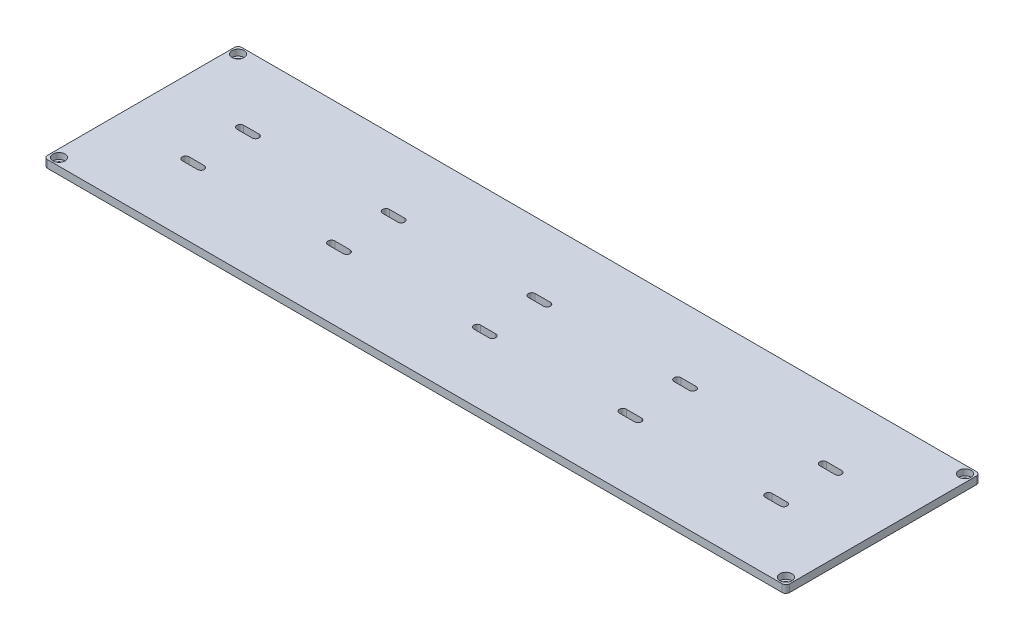
from build123d import *

# Parameters (mm, degrees)
SKETCH1_W                      = 488.95
SKETCH1_H                      = 128
BOSS_EXTRUDE1_DEPTH            = 5
CBORE_FOR_M4_SHCS1_D           = 4.5
CBORE_FOR_M4_SHCS1_DEPTH       = 17.38
CBORE_FOR_M4_SHCS1_CBORE_D     = 8
CBORE_FOR_M4_SHCS1_CBORE_DEPTH = 4
CBORE_FOR_M4_SHCS1_TIP         = 1.351936393
FILLET1_R                      = 2.5
CUT_EXTRUDE1_DEPTH             = 253.762785285
LPATTERN1_COUNT                = 5
LPATTERN1_PITCH                = 96


with BuildPart() as part:
    # Sketch1 → Boss-Extrude1 (new body)
    with BuildSketch(Plane(origin=(0, 0, 0), x_dir=(1, 0, 0), z_dir=(0, 1, 0))):
        Rectangle(SKETCH1_W, SKETCH1_H)
    extrude(amount=BOSS_EXTRUDE1_DEPTH)

    # CBORE for M4 SHCS1
    with Locations(Plane(origin=(0, 5, 0), x_dir=(1, 0, 0), z_dir=(0, 1, 0))):
        with Locations((-239.475, 59), (-239.475, -59), (239.475, -59), (239.475, 59)):
            CounterBoreHole(CBORE_FOR_M4_SHCS1_D / 2, CBORE_FOR_M4_SHCS1_CBORE_D / 2, CBORE_FOR_M4_SHCS1_CBORE_DEPTH, depth=CBORE_FOR_M4_SHCS1_DEPTH)
            with Locations((0, 0, -(CBORE_FOR_M4_SHCS1_DEPTH + CBORE_FOR_M4_SHCS1_TIP / 2))):  # 118° drill point
                Cone(0, CBORE_FOR_M4_SHCS1_D / 2, CBORE_FOR_M4_SHCS1_TIP, mode=Mode.SUBTRACT)

    # Fillet1
    fillet1_edges = [part.edges().sort_by_distance(p)[0] for p in [
        (244.475, 2.5, 64),
        (-244.475, 2.5, 64),
        (-244.475, 2.5, -64),
        (244.475, 2.5, -64),
    ]]
    fillet(fillet1_edges, radius=FILLET1_R)

    # Sketch4 → Cut-Extrude1 (cut, through all)
    with BuildSketch(Plane(origin=(0, 5, 0), x_dir=(1, 0, 0), z_dir=(0, 1, 0))):
        with BuildLine():
            Line((-196.975, 20.25), (-186.975, 20.25))
            ThreePointArc((-186.975, 20.25), (-184.725, 18), (-186.975, 15.75))
            Line((-186.975, 15.75), (-196.975, 15.75))
            ThreePointArc((-196.975, 15.75), (-199.225, 18), (-196.975, 20.25))
        make_face()
        with BuildLine():
            Line((-196.975, -15.75), (-186.975, -15.75))
            ThreePointArc((-186.975, -15.75), (-184.725, -18), (-186.975, -20.25))
            Line((-186.975, -20.25), (-196.975, -20.25))
            ThreePointArc((-196.975, -20.25), (-199.225, -18), (-196.975, -15.75))
        make_face()
    cut_extrude1 = extrude(amount=-CUT_EXTRUDE1_DEPTH, mode=Mode.SUBTRACT)

    # LPattern1: Cut-Extrude1 ×5
    with Locations(*[(i * LPATTERN1_PITCH, 0, 0) for i in range(1, LPATTERN1_COUNT)]):
        add(cut_extrude1, mode=Mode.SUBTRACT)


solid = part.part
